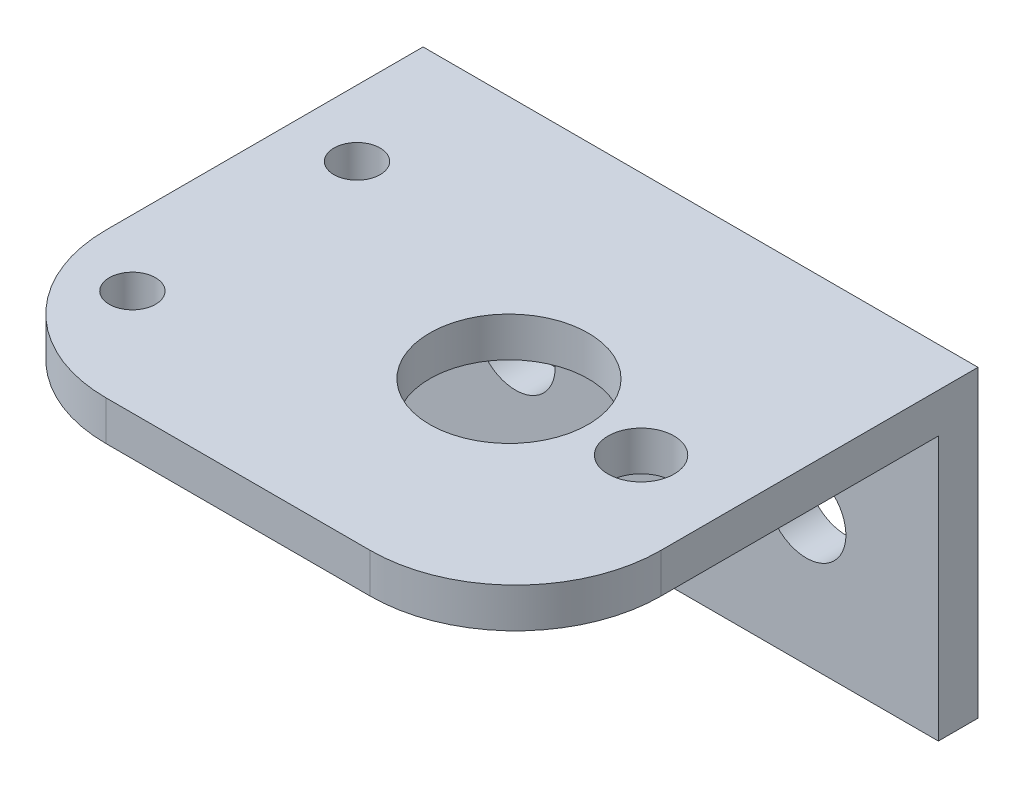
from build123d import *

# Parameters (mm, degrees)
SKETCH1_W           = 42
SKETCH1_H           = 35
SKETCH1_R           = 1.75
SKETCH1_R_2         = 6
SKETCH1_R_3         = 2.5
BOSS_EXTRUDE1_DEPTH = 3
SKETCH2_W           = 42
SKETCH2_H           = 3
BOSS_EXTRUDE2_DEPTH = 20
SKETCH3_R           = 3
CUT_EXTRUDE1_DEPTH  = 20
FILLET1_R           = 11


with BuildPart() as part:
    # Sketch1 → Boss-Extrude1 (new body)
    with BuildSketch(Plane(origin=(0, 0, 0), x_dir=(1, 0, 0), z_dir=(0, 1, 0))):
        with Locations((21, -17.5)):
            Rectangle(SKETCH1_W, SKETCH1_H)
        with Locations(Location((5, -10, 0), (0, 0, 270))):
            Circle(SKETCH1_R, mode=Mode.SUBTRACT)
        with Locations(Location((5, -27, 0), (0, 0, 270))):
            Circle(SKETCH1_R, mode=Mode.SUBTRACT)
        with Locations(Location((25, -18.5, 0), (0, 0, 270))):
            Circle(SKETCH1_R_2, mode=Mode.SUBTRACT)
        with Locations(Location((35, -18.5, 0), (0, 0, 270))):
            Circle(SKETCH1_R_3, mode=Mode.SUBTRACT)
    extrude(amount=BOSS_EXTRUDE1_DEPTH)

    # Sketch2 → Boss-Extrude2 (add)
    with BuildSketch(Plane.XZ):
        with Locations((21, 1.5)):
            Rectangle(SKETCH2_W, SKETCH2_H)
    extrude(amount=BOSS_EXTRUDE2_DEPTH)

    # Sketch3 → Cut-Extrude1 (cut)
    with BuildSketch(Plane(origin=(0, 0, 0), x_dir=(-1, 0, 0), z_dir=(0, 0, -1))):
        with Locations((-32, -10)):
            Circle(SKETCH3_R)
        with Locations((-10, -10)):
            Circle(SKETCH3_R)
    extrude(amount=-CUT_EXTRUDE1_DEPTH, mode=Mode.SUBTRACT)

    # Fillet1
    fillet1_edges = [part.edges().sort_by_distance(p)[0] for p in [
        (42, 1.5, 35),
        (0, 1.5, 35),
    ]]
    fillet(fillet1_edges, radius=FILLET1_R)


solid = part.part
